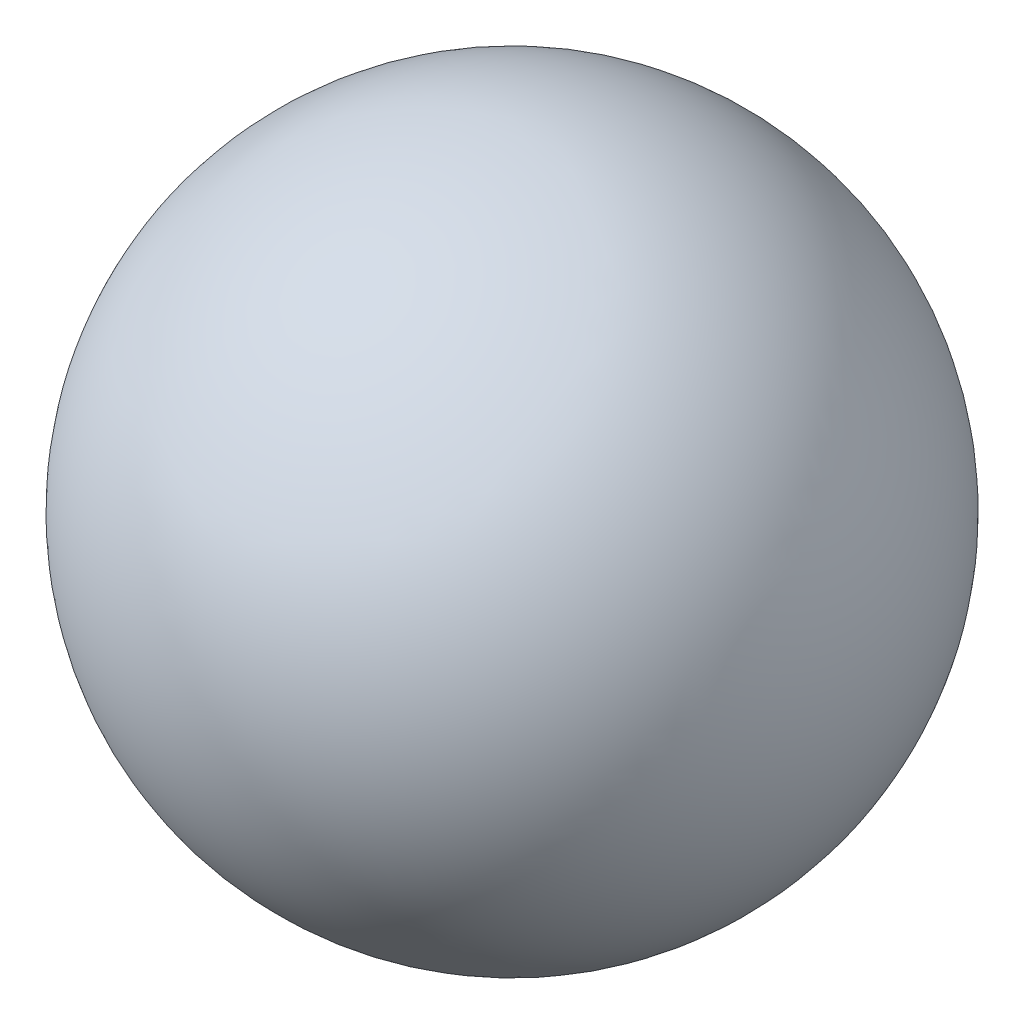
from build123d import *


with BuildPart() as part:
    # Эскиз1 → Повернуть4 (revolve)
    with BuildSketch(Plane(origin=(0, 0, 0), x_dir=(1, 0, 0), z_dir=(0, 1, 0))):
        with BuildLine():
            Line((-5.888593261, 0), (12.411406739, 0))
            ThreePointArc((12.411406739, 0), (3.261406739, 9.15), (-5.888593261, 0))
        make_face()
    revolve(axis=Axis((-15.750185547, 0, 0), (1, 0, 0)))


solid = part.part
